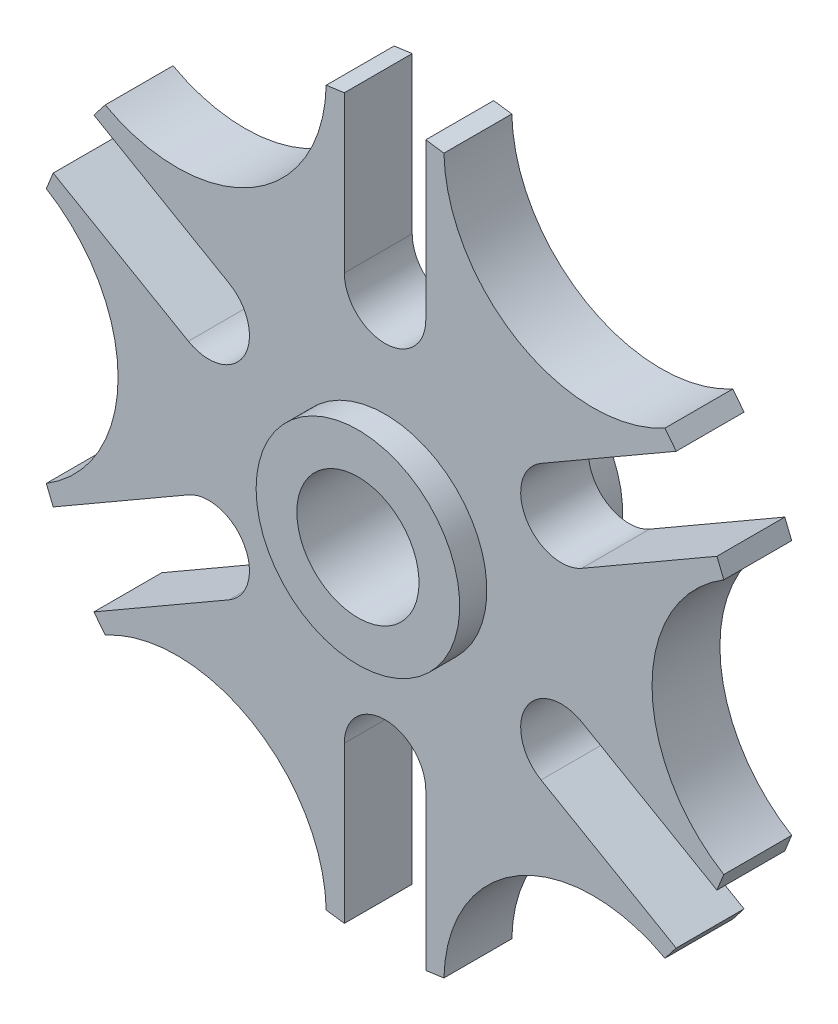
from build123d import *

# Parameters (mm, degrees)
FORO_7_5_7_5_1_D         = 7.5
SCHIZZO9_OUTSIDE_W       = 207.824
SCHIZZO9_OUTSIDE_H       = 207.824
TAGLIO_ESTRUSIONE1_DEPTH = 116.069544208


with BuildPart() as part:
    # Schizzo6 → Rivoluzione1 (revolve)
    with BuildSketch(Plane(origin=(0, 0, 0), x_dir=(1, 0, 0), z_dir=(0, 1, 0)), mode=Mode.PRIVATE) as rivoluzione1_sk:
        Polygon((13.5, 0), (13.5, 36), (22.5, 36), (22.5, 21), (80, 21), (80, 6), (22.5, 6), (22.5, 0), align=None)
    revolve(rivoluzione1_sk.sketch.rotate(Axis((0, 0, -47.894415312), (0, 0, 1)), 180), axis=Axis((0, 0, -47.894415312), (0, 0, 1)))

    # Foro Ø7.5 (7.5)-1 (through all)
    with Locations(Plane(origin=(22.5, 0, 0), x_dir=(0, 0, -1), z_dir=(1, 0, 0))):
        with Locations((28.5, 0)):
            Hole(FORO_7_5_7_5_1_D / 2)

    # Schizzo9 outside → Taglio-Estrusione1 (cut, through all)
    with BuildSketch(Plane(origin=(0, 0, -21), x_dir=(-1, 0, 0), z_dir=(0, 0, -1))):
        Rectangle(SCHIZZO9_OUTSIDE_W, SCHIZZO9_OUTSIDE_H)
        with BuildLine():
            Line((9, 79.492137976), (9, 45))
            ThreePointArc((9, 45), (0, 36), (-9, 45))
            Line((-9, 45), (-9, 79.492137976))
            Line((-9, 79.492137976), (-13.008275981, 78.935320079))
            ThreePointArc((-13.008275981, 78.935320079), (-29.5, 51.095498823), (-61.855854454, 50.733157498))
            Line((-61.855854454, 50.733157498), (-64.342210888, 47.540297622))
            Line((-64.342210888, 47.540297622), (-34.47114317, 30.294228634))
            ThreePointArc((-34.47114317, 30.294228634), (-31.176914536, 18), (-43.47114317, 14.705771366))
            Line((-43.47114317, 14.705771366), (-73.342210888, 31.951840354))
            Line((-73.342210888, 31.951840354), (-74.864130435, 28.202162581))
            ThreePointArc((-74.864130435, 28.202162581), (-59, 0), (-74.864130435, -28.202162581))
            Line((-74.864130435, -28.202162581), (-73.342210888, -31.951840354))
            Line((-73.342210888, -31.951840354), (-43.47114317, -14.705771366))
            ThreePointArc((-43.47114317, -14.705771366), (-31.176914536, -18), (-34.47114317, -30.294228634))
            Line((-34.47114317, -30.294228634), (-64.342210888, -47.540297622))
            Line((-64.342210888, -47.540297622), (-61.855854454, -50.733157498))
            ThreePointArc((-61.855854454, -50.733157498), (-29.5, -51.095498823), (-13.008275981, -78.935320079))
            Line((-13.008275981, -78.935320079), (-9, -79.492137976))
            Line((-9, -79.492137976), (-9, -45))
            ThreePointArc((-9, -45), (0, -36), (9, -45))
            Line((9, -45), (9, -79.492137976))
            Line((9, -79.492137976), (13.008275981, -78.935320079))
            ThreePointArc((13.008275981, -78.935320079), (29.5, -51.095498823), (61.855854454, -50.733157498))
            Line((61.855854454, -50.733157498), (64.342210888, -47.540297622))
            Line((64.342210888, -47.540297622), (34.47114317, -30.294228634))
            ThreePointArc((34.47114317, -30.294228634), (31.176914536, -18), (43.47114317, -14.705771366))
            Line((43.47114317, -14.705771366), (73.342210888, -31.951840354))
            Line((73.342210888, -31.951840354), (74.864130435, -28.202162581))
            ThreePointArc((74.864130435, -28.202162581), (59, 0), (74.864130435, 28.202162581))
            Line((74.864130435, 28.202162581), (73.342210888, 31.951840354))
            Line((73.342210888, 31.951840354), (43.47114317, 14.705771366))
            ThreePointArc((43.47114317, 14.705771366), (31.176914536, 18), (34.47114317, 30.294228634))
            Line((34.47114317, 30.294228634), (64.342210888, 47.540297622))
            Line((64.342210888, 47.540297622), (61.855854454, 50.733157498))
            ThreePointArc((61.855854454, 50.733157498), (29.5, 51.095498823), (13.008275981, 78.935320079))
            Line((13.008275981, 78.935320079), (9, 79.492137976))
        make_face(mode=Mode.SUBTRACT)
    extrude(amount=-TAGLIO_ESTRUSIONE1_DEPTH, mode=Mode.SUBTRACT)


solid = part.part
